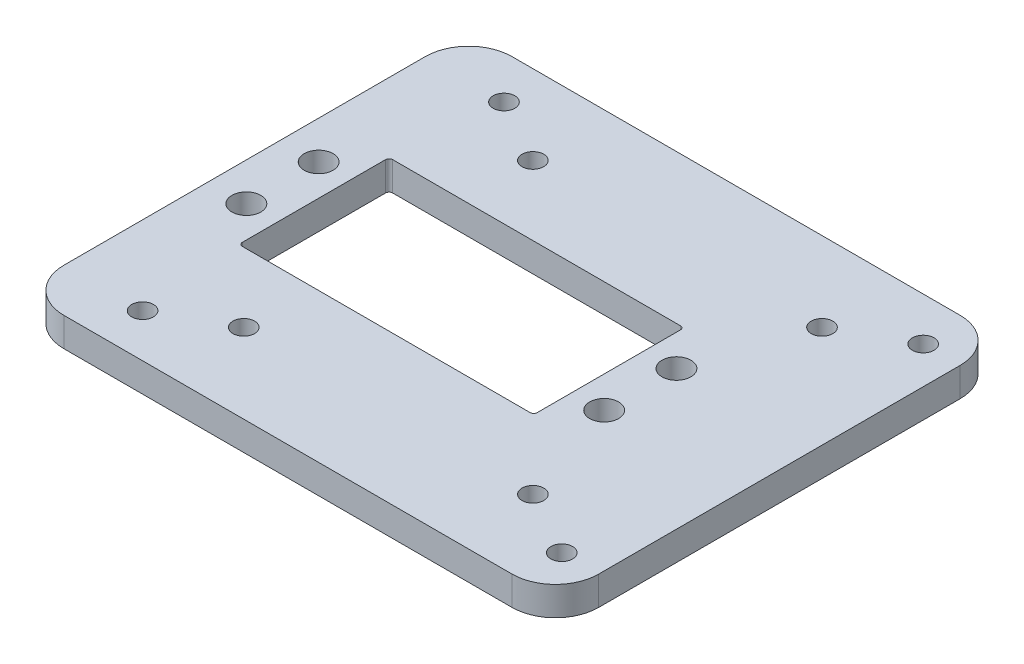
from build123d import *

# Parameters (mm, degrees)
SKETCH_1_W      = 74
SKETCH_1_H      = 62
SKETCH_1_R      = 1.5
SKETCH_1_R_2    = 2
SKETCH_1_W_2    = 40.8
SKETCH_1_H_2    = 20.8
EXTRUDE_1_DEPTH = 4
FILLET_1_R      = 0.5
FILLET_2_R      = 6


with BuildPart() as part:
    # 草图1 → 凸台-拉伸1 (new body)
    with BuildSketch(Plane(origin=(0, 0, 0), x_dir=(1, 0, 0), z_dir=(0, 1, 0))):
        with Locations((7, 0)):
            Rectangle(SKETCH_1_W, SKETCH_1_H)
        with Locations(Location((29.89, 20, 0), (0, 0, 270))):
            Circle(SKETCH_1_R, mode=Mode.SUBTRACT)
        with Locations(Location((29.89, -20, 0), (0, 0, 270))):
            Circle(SKETCH_1_R, mode=Mode.SUBTRACT)
        with Locations(Location((-19.11, -25, 0), (0, 0, 270))):
            Circle(SKETCH_1_R, mode=Mode.SUBTRACT)
        with Locations(Location((-10.11, -20, 0), (0, 0, 270))):
            Circle(SKETCH_1_R, mode=Mode.SUBTRACT)
        with Locations(Location((-24.75, -5, 0), (0, 0, 270))):
            Circle(SKETCH_1_R_2, mode=Mode.SUBTRACT)
        with Locations(Location((24.75, -5, 0), (0, 0, 270))):
            Circle(SKETCH_1_R_2, mode=Mode.SUBTRACT)
        with Locations(Location((-24.75, 5, 0), (0, 0, 270))):
            Circle(SKETCH_1_R_2, mode=Mode.SUBTRACT)
        Rectangle(SKETCH_1_W_2, SKETCH_1_H_2, mode=Mode.SUBTRACT)
        with Locations(Location((-19.11, 25, 0), (0, 0, 270))):
            Circle(SKETCH_1_R, mode=Mode.SUBTRACT)
        with Locations(Location((-10.11, 20, 0), (0, 0, 270))):
            Circle(SKETCH_1_R, mode=Mode.SUBTRACT)
        with Locations(Location((24.75, 5, 0), (0, 0, 270))):
            Circle(SKETCH_1_R_2, mode=Mode.SUBTRACT)
        with Locations(Location((38.89, -25, 0), (0, 0, 270))):
            Circle(SKETCH_1_R, mode=Mode.SUBTRACT)
        with Locations(Location((38.89, 25, 0), (0, 0, 270))):
            Circle(SKETCH_1_R, mode=Mode.SUBTRACT)
    extrude(amount=EXTRUDE_1_DEPTH)

    # 圆角1
    fillet_1_edges = [part.edges().sort_by_distance(p)[0] for p in [
        (20.4, 2, -10.4),
        (-20.4, 2, -10.4),
        (-20.4, 2, 10.4),
        (20.4, 2, 10.4),
    ]]
    fillet(fillet_1_edges, radius=FILLET_1_R)

    # 圆角2
    fillet_2_edges = [part.edges().sort_by_distance(p)[0] for p in [
        (44, 2, 31),
        (-30, 2, 31),
        (-30, 2, -31),
        (44, 2, -31),
    ]]
    fillet(fillet_2_edges, radius=FILLET_2_R)


solid = part.part
